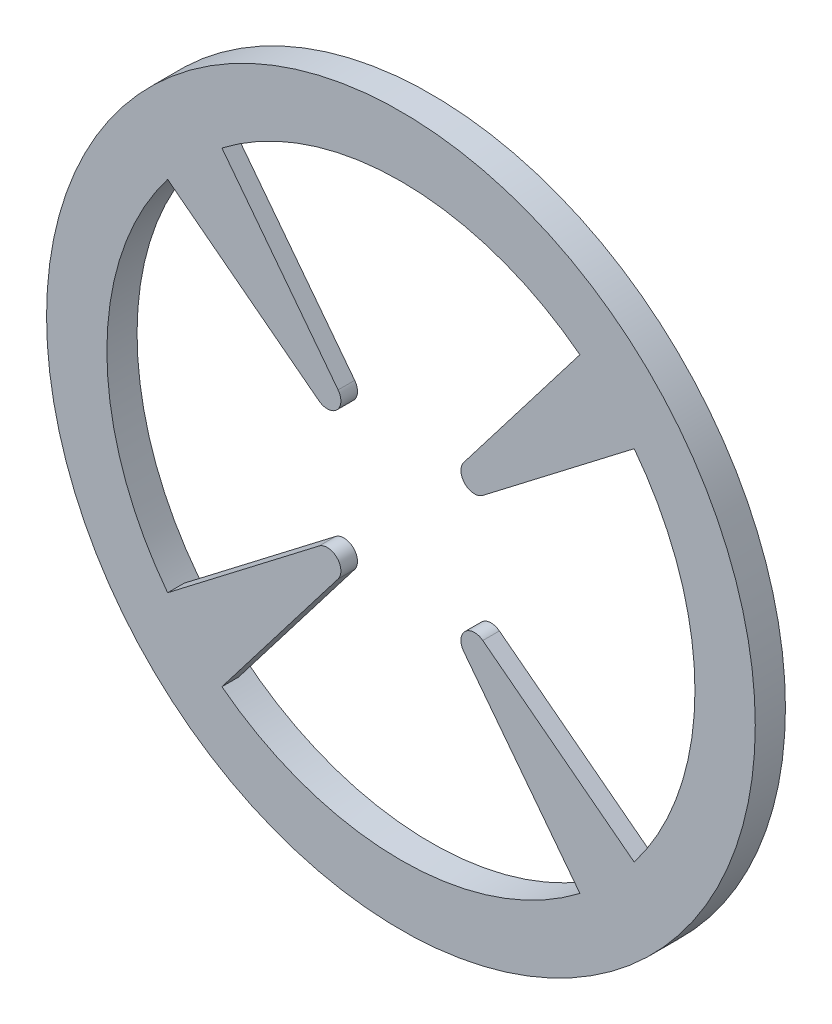
from build123d import *

# Parameters (mm, degrees)
SKETCH_1_R      = 1.174760425
SKETCH_1_R_2    = 0.974760425
EXTRUDE_1_DEPTH = 0.1
EXTRUDE_START   = -0.055
EXTRUDE_2_DEPTH = 0.055


with BuildPart() as part:
    # 草圖1 → 填料-伸長1 (new body)
    with BuildSketch(Plane.XY):
        Circle(SKETCH_1_R)
        Circle(SKETCH_1_R_2, mode=Mode.SUBTRACT)
    extrude(amount=EXTRUDE_1_DEPTH)

    # 草圖2 → 填料-伸長2 (add)
    with BuildSketch(Plane.XY.offset(0.1).offset(EXTRUDE_START)):
        with BuildLine():
            Line((-0.208247811, 0.271393831), (-0.59339655, 0.77332944))
            ThreePointArc((-0.59339655, 0.77332944), (-0.689259707, 0.689259707), (-0.77332944, 0.59339655))
            Line((-0.77332944, 0.59339655), (-0.271393831, 0.208247811))
            ThreePointArc((-0.271393831, 0.208247811), (-0.241031974, 0.199037642), (-0.212132034, 0.212132034))
            ThreePointArc((-0.212132034, 0.212132034), (-0.199037642, 0.241031974), (-0.208247811, 0.271393831))
        make_face()
        with BuildLine():
            ThreePointArc((0.208247811, 0.271393831), (0.199037642, 0.241031974), (0.212132034, 0.212132034))
            ThreePointArc((0.212132034, 0.212132034), (0.241031974, 0.199037642), (0.271393831, 0.208247811))
            Line((0.271393831, 0.208247811), (0.77332944, 0.59339655))
            ThreePointArc((0.77332944, 0.59339655), (0.689259707, 0.689259707), (0.59339655, 0.77332944))
            Line((0.59339655, 0.77332944), (0.208247811, 0.271393831))
        make_face()
        with BuildLine():
            ThreePointArc((0.271393831, -0.208247811), (0.241031974, -0.199037642), (0.212132034, -0.212132034))
            ThreePointArc((0.212132034, -0.212132034), (0.199037642, -0.241031974), (0.208247811, -0.271393831))
            Line((0.208247811, -0.271393831), (0.59339655, -0.77332944))
            ThreePointArc((0.59339655, -0.77332944), (0.689259707, -0.689259707), (0.77332944, -0.59339655))
            Line((0.77332944, -0.59339655), (0.271393831, -0.208247811))
        make_face()
        with BuildLine():
            ThreePointArc((-0.208247811, -0.271393831), (-0.199037642, -0.241031974), (-0.212132034, -0.212132034))
            ThreePointArc((-0.212132034, -0.212132034), (-0.241031974, -0.199037642), (-0.271393831, -0.208247811))
            Line((-0.271393831, -0.208247811), (-0.77332944, -0.59339655))
            ThreePointArc((-0.77332944, -0.59339655), (-0.689259707, -0.689259707), (-0.59339655, -0.77332944))
            Line((-0.59339655, -0.77332944), (-0.208247811, -0.271393831))
        make_face()
    extrude(amount=EXTRUDE_2_DEPTH)


solid = part.part
